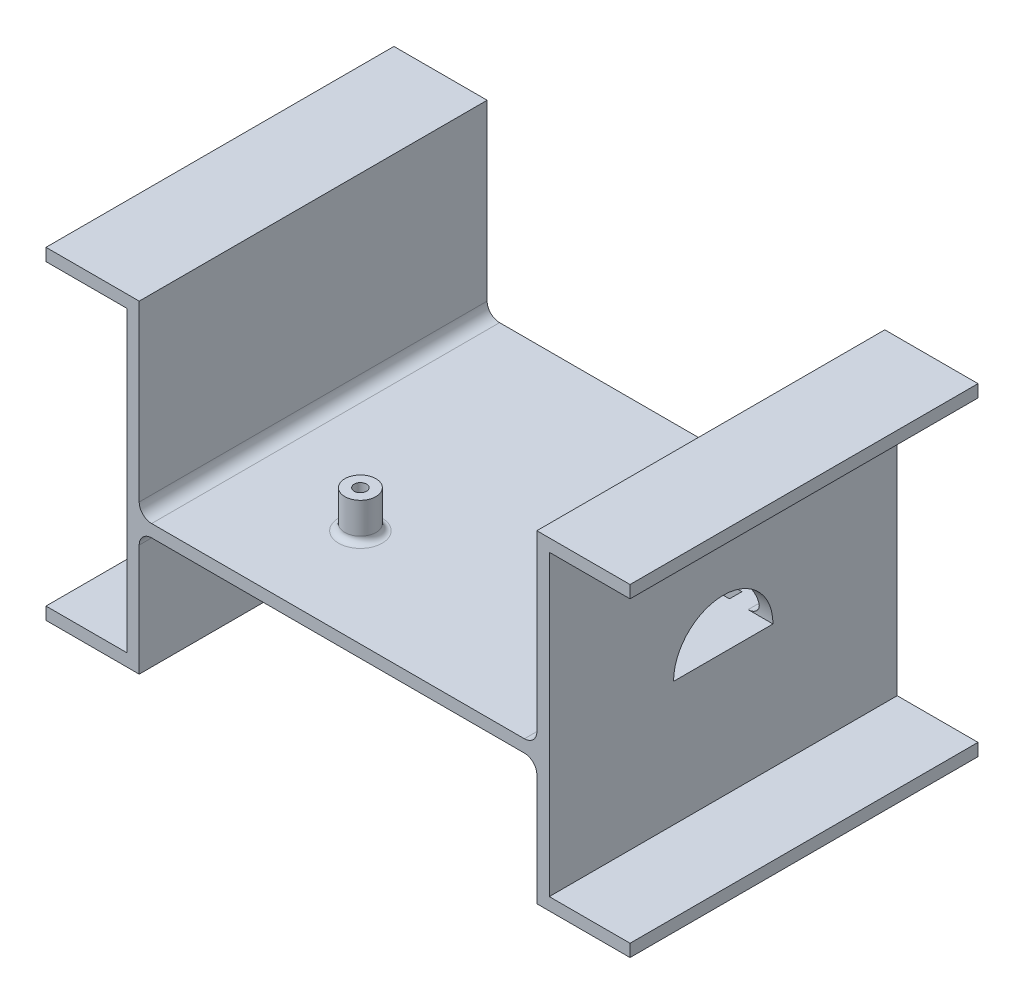
from build123d import *

# Parameters (mm, degrees)
BOSS_EXTRUDE2_DEPTH = 56
SKETCH2_R           = 2.5
SKETCH2_R_2         = 1
BOSS_EXTRUDE3_DEPTH = 6
CUT_EXTRUDE1_START  = -31
SKETCH3_R           = 1
CUT_EXTRUDE1_DEPTH  = 31
SKETCH2_3_W         = 6
SKETCH2_3_H         = 2
CUT_EXTRUDE2_DEPTH  = 31
CUT_EXTRUDE3_DEPTH  = 31
FILLET1_R           = 1
FILLET2_R           = 2


with BuildPart() as part:
    # Sketch1 → Boss-Extrude2 (new body)
    with BuildSketch(Plane.XY):
        Polygon((0, 48), (0, 0), (-13, 0), (-13, -2), (2, -2), (2, 18), (66, 18), (66, -2), (81, -2), (81, 0), (68, 0), (68, 48), (81, 48), (81, 50), (66, 50), (66, 20), (2, 20), (2, 50), (-13, 50), (-13, 48), align=None)
    extrude(amount=BOSS_EXTRUDE2_DEPTH)

    # Sketch2 → Boss-Extrude3 (add)
    # profile 1 of 2: a face of its own
    with BuildSketch(Plane(origin=(0, 20, 0), x_dir=(1, 0, 0), z_dir=(0, 1, 0))):
        with Locations((46.2, -15.8)):
            Circle(SKETCH2_R)
        with Locations((46.2, -15.8)):
            Circle(SKETCH2_R_2, mode=Mode.SUBTRACT)
    # profile 2 of 2: a face of its own
    with BuildSketch(Plane(origin=(0, 20, 0), x_dir=(1, 0, 0), z_dir=(0, 1, 0))):
        with Locations((21.8, -40.2)):
            Circle(SKETCH2_R)
        with Locations((21.8, -40.2)):
            Circle(SKETCH2_R_2, mode=Mode.SUBTRACT)
    extrude(amount=BOSS_EXTRUDE3_DEPTH)

    # Sketch3 → Cut-Extrude1 (cut)
    with BuildSketch(Plane(origin=(0, 20, 0), x_dir=(1, 0, 0), z_dir=(0, 1, 0)).offset(CUT_EXTRUDE1_START)):
        with Locations((46.2, -15.8)):
            Circle(SKETCH3_R)
        with Locations((21.8, -40.2)):
            Circle(SKETCH3_R)
    extrude(amount=CUT_EXTRUDE1_DEPTH, mode=Mode.SUBTRACT)

    # Sketch2<3> → Cut-Extrude2 (cut)
    with BuildSketch(Plane(origin=(0, 20, 0), x_dir=(1, 0, 0), z_dir=(0, 1, 0))):
        with Locations((58, -19)):
            Rectangle(SKETCH2_3_W, SKETCH2_3_H)
        with Locations((58, -37)):
            Rectangle(SKETCH2_3_W, SKETCH2_3_H)
    extrude(amount=-CUT_EXTRUDE2_DEPTH, mode=Mode.SUBTRACT)

    # Sketch6 → Cut-Extrude3 (cut)
    with BuildSketch(Plane.ZY.offset(-66)):
        with BuildLine():
            Line((35.999989218, 20), (20.000010782, 20))
            ThreePointArc((20.000010782, 20), (28, 27.999989218), (35.999989218, 20))
        make_face()
    extrude(amount=-CUT_EXTRUDE3_DEPTH, mode=Mode.SUBTRACT)

    # Fillet1
    fillet1_edges = [part.edges().sort_by_distance(p)[0] for p in [
        (19.3, 20, 40.2),
        (43.7, 20, 15.8),
    ]]
    fillet(fillet1_edges, radius=FILLET1_R)

    # Fillet2
    fillet2_edges = [part.edges().sort_by_distance(p)[0] for p in [
        (2, 18, 28),
        (66, 18, 28),
        (2, 20, 28),
        (66, 20, 45.999994609),
        (66, 20, 10.000005391),
    ]]
    fillet(fillet2_edges, radius=FILLET2_R)


solid = part.part
